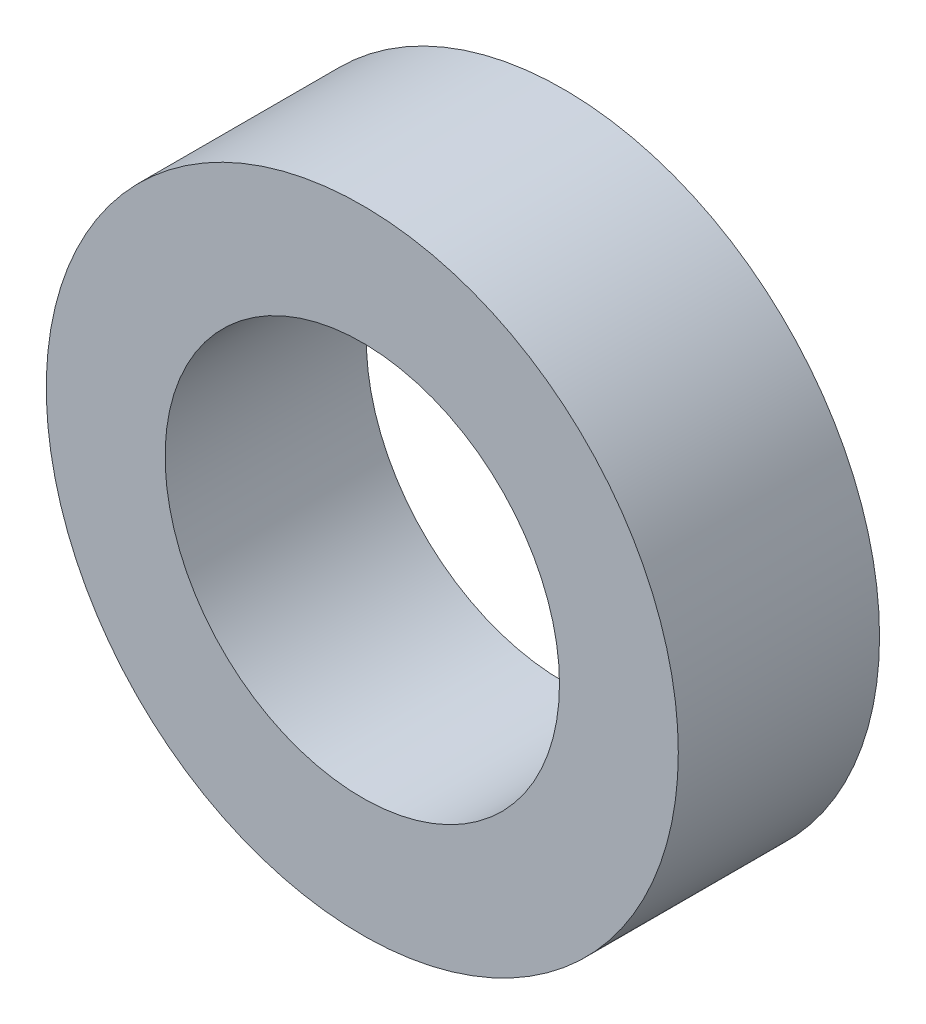
from build123d import *

# Parameters (mm, degrees)
SKETCH1_R           = 15.875
SKETCH1_R_2         = 9.906
BOSS_EXTRUDE1_DEPTH = 10.1092


with BuildPart() as part:
    # Sketch1 → Boss-Extrude1 (new body)
    with BuildSketch(Plane.XY):
        Circle(SKETCH1_R)
        Circle(SKETCH1_R_2, mode=Mode.SUBTRACT)
    extrude(amount=BOSS_EXTRUDE1_DEPTH)


solid = part.part
